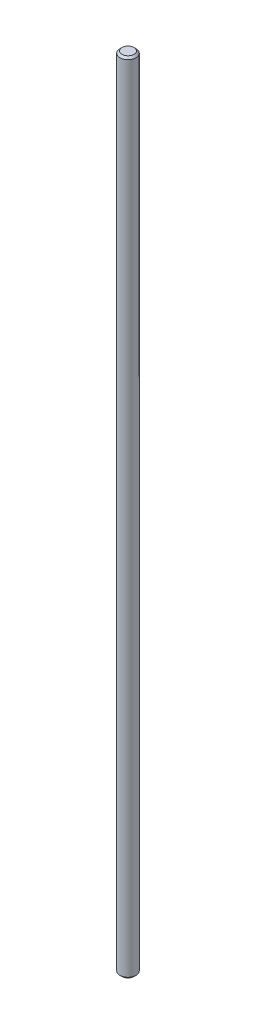
from build123d import *

# Parameters (mm, degrees)
SKETCH_1_R      = 4000
EXTRUDE_1_DEPTH = 400000
CHAMFER_1_SIZE  = 1000


with BuildPart() as part:
    # 草圖1 → 填料-伸長1 (new body)
    with BuildSketch(Plane(origin=(0, 0, 0), x_dir=(1, 0, 0), z_dir=(0, 1, 0))):
        with Locations(Location((0, 0, 0), (0, 0, 270))):
            Circle(SKETCH_1_R)
    extrude(amount=EXTRUDE_1_DEPTH)

    # 導角1
    chamfer_1_edges = [part.edges().sort_by_distance(p)[0] for p in [
        (0, 0, -4000),
        (0, 400000, -4000),
    ]]
    chamfer(chamfer_1_edges, length=CHAMFER_1_SIZE)


solid = part.part
